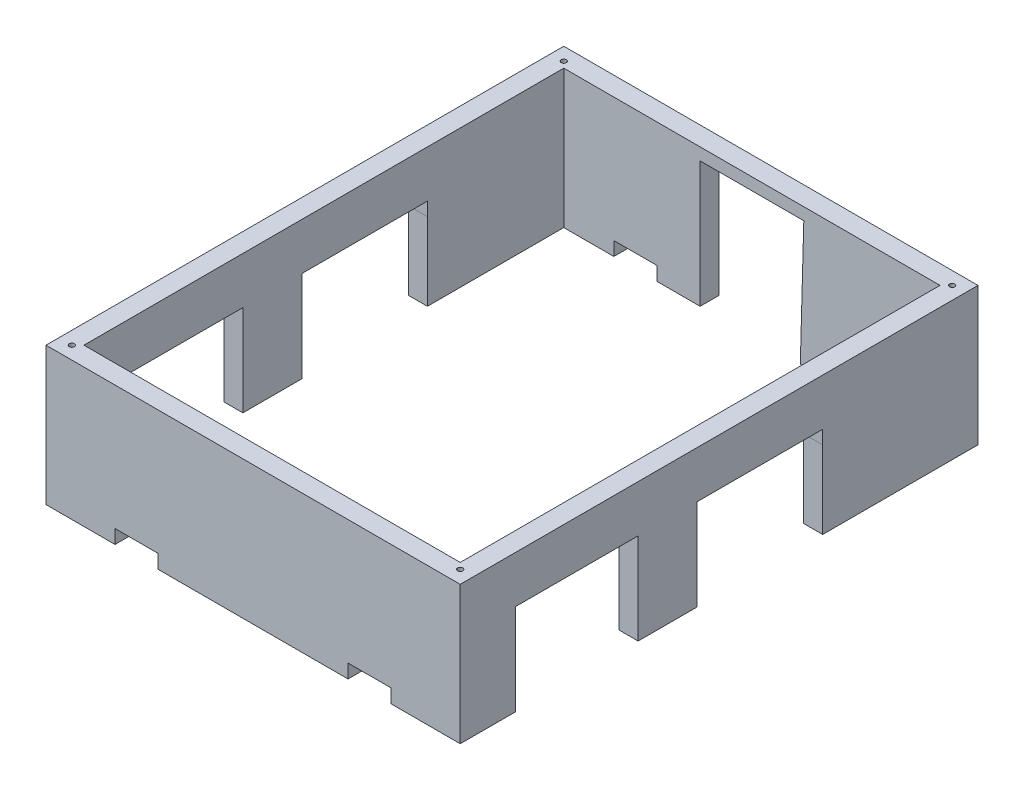
from build123d import *

# Parameters (mm, degrees)
SKETCH1_W               = 240
SKETCH1_H               = 300
BOSS_EXTRUDE1_DEPTH     = 80
SHELL1_T                = -11
SKETCH4_R               = 1.5
CUT_EXTRUDE2_DEPTH      = 209.086520467
MIRROR2_COPY_1_SKETCH_R = 1.5
MIRROR2_COPY_1_DEPTH    = 209.086520467
SKETCH16_W              = 25
SKETCH16_H              = 8
CUT_EXTRUDE9_DEPTH      = 333.866339542
SKETCH18_W              = 71.1
SKETCH18_H              = 45
SKETCH18_W_2            = 72.7
CUT_EXTRUDE10_DEPTH     = 295.108823397
SKETCH19_W              = 71.1
SKETCH19_H              = 7.810897368
SKETCH19_W_2            = 72.674166019
CUT_EXTRUDE11_DEPTH     = 295.108823397
CUT_EXTRUDE12_DEPTH     = 15


with BuildPart() as part:
    # Sketch1 → Boss-Extrude1 (new body)
    with BuildSketch(Plane(origin=(0, 0, 0), x_dir=(1, 0, 0), z_dir=(0, 1, 0))):
        Rectangle(SKETCH1_W, SKETCH1_H)
    extrude(amount=BOSS_EXTRUDE1_DEPTH)

    # Shell1
    shell1_openings = [part.faces().sort_by_distance(p)[0] for p in [
        (0, 80, 0),
        (0, 0, 0),
    ]]
    offset(amount=SHELL1_T, openings=shell1_openings, kind=Kind.INTERSECTION)

    # Sketch4 → Cut-Extrude2 (cut, through all)
    with BuildSketch(Plane(origin=(0, 80, 0), x_dir=(1, 0, 0), z_dir=(0, 1, 0))):
        with Locations(Location((-112.5, 142.5, 0), (0, 0, 270))):
            Circle(SKETCH4_R)
    cut_extrude2 = extrude(amount=-CUT_EXTRUDE2_DEPTH, mode=Mode.SUBTRACT)

    # Mirror1: Cut-Extrude2 across plane
    add(cut_extrude2.mirror(Plane(origin=(0, 0, 0), x_dir=(0, 0, 1), z_dir=(1, 0, 0))), mode=Mode.SUBTRACT)

    # Mirror2: Cut-Extrude2 across plane
    add(cut_extrude2.mirror(Plane.XY), mode=Mode.SUBTRACT)

    # Mirror2 copy 1 sketch → Mirror2 copy 1 (cut, through all)
    with BuildSketch(Plane(origin=(0, 80, 0), x_dir=(-1, 0, 0), z_dir=(0, 1, 0))):
        with Locations(Location((-112.5, 142.5, 0), (0, 0, 270))):
            Circle(MIRROR2_COPY_1_SKETCH_R)
    extrude(amount=-MIRROR2_COPY_1_DEPTH, mode=Mode.SUBTRACT)

    # Sketch16 → Cut-Extrude9 (cut, through all)
    with BuildSketch(Plane.XY.offset(150)):
        with Locations((-67.5, 4)):
            Rectangle(SKETCH16_W, SKETCH16_H)
    cut_extrude9 = extrude(amount=-CUT_EXTRUDE9_DEPTH, mode=Mode.SUBTRACT)

    # Mirror3: Cut-Extrude9 across plane
    add(cut_extrude9.mirror(Plane(origin=(0, 0, 0), x_dir=(0, 0, 1), z_dir=(1, 0, 0))), mode=Mode.SUBTRACT)

    # Sketch18 → Cut-Extrude10 (cut, through all)
    with BuildSketch(Plane(origin=(120, 0, 0), x_dir=(0, 0, -1), z_dir=(1, 0, 0))):
        with Locations((-82.48, 22.5)):
            Rectangle(SKETCH18_W, SKETCH18_H)
        with Locations((23.65, 22.5)):
            Rectangle(SKETCH18_W_2, SKETCH18_H)
    extrude(amount=-CUT_EXTRUDE10_DEPTH, mode=Mode.SUBTRACT)

    # Sketch19 → Cut-Extrude11 (cut, through all)
    with BuildSketch(Plane(origin=(120, 0, 0), x_dir=(0, 0, -1), z_dir=(1, 0, 0))):
        with Locations((-82.48, 48.905448684)):
            Rectangle(SKETCH19_W, SKETCH19_H)
        with Locations((23.637083009, 48.905448684)):
            Rectangle(SKETCH19_W_2, SKETCH19_H)
    extrude(amount=-CUT_EXTRUDE11_DEPTH, mode=Mode.SUBTRACT)

    # Sketch22 → Cut-Extrude12 (cut)
    with BuildSketch(Plane(origin=(0, 0, -150), x_dir=(-1, 0, 0), z_dir=(0, 0, -1))):
        Polygon((-28.041535061, 0), (30, 0), (30, 72.971763315), (-30.071746562, 72.971763315), align=None)
    extrude(amount=-CUT_EXTRUDE12_DEPTH, mode=Mode.SUBTRACT)


solid = part.part
